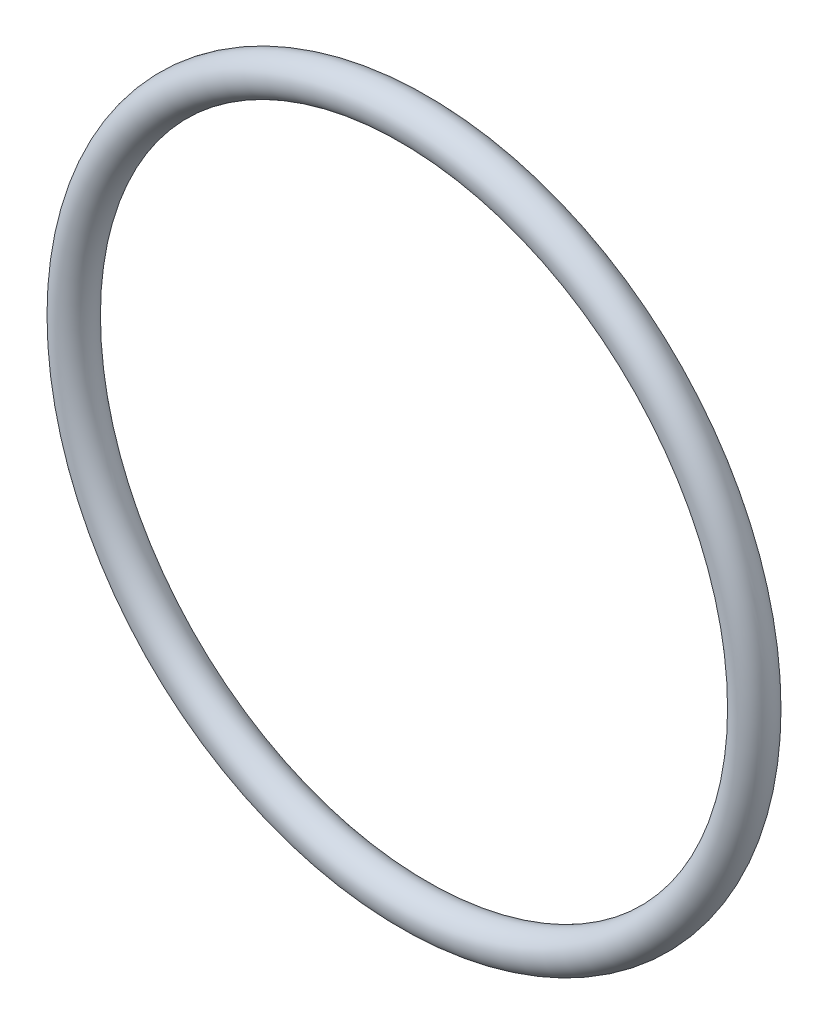
from build123d import *

# Parameters (mm, degrees)
SKETCH3_R   = 50
SKETCH3_R_2 = 35


with BuildPart() as part:
    # Sweep1: sweep along a path in Sketch2
    with BuildLine(Plane.XY) as sweep1_path:
        CenterArc((900, 0), 900, 0, 360)
    # Sketch3 → Sweep1 (sweep)
    with BuildSketch(Plane(origin=(0, 0, 0), x_dir=(1, 0, 0), z_dir=(0, 1, 0))):
        Circle(SKETCH3_R)
        Circle(SKETCH3_R_2, mode=Mode.SUBTRACT)
    sweep(path=sweep1_path.line)


solid = part.part
